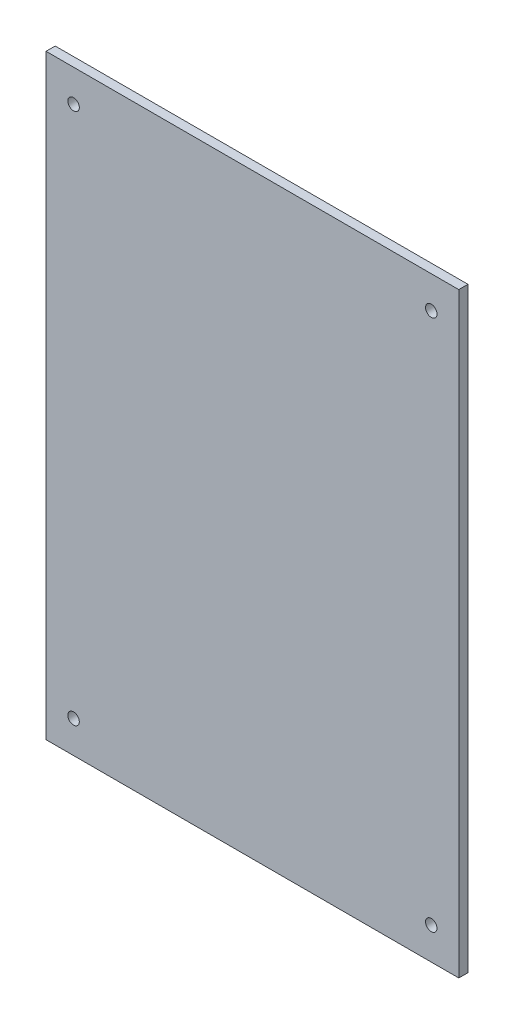
from build123d import *

# Parameters (mm, degrees)
SKETCH1_W     = 180
SKETCH1_H     = 260
SKETCH1_R     = 2.5
PROFILE_DEPTH = 4


with BuildPart() as part:
    # Sketch1 → Profile (new body)
    with BuildSketch(Plane.XY):
        with Locations((90, 130)):
            Rectangle(SKETCH1_W, SKETCH1_H)
        with Locations((12, 14)):
            Circle(SKETCH1_R, mode=Mode.SUBTRACT)
        with Locations((12, 246)):
            Circle(SKETCH1_R, mode=Mode.SUBTRACT)
        with Locations((168, 14)):
            Circle(SKETCH1_R, mode=Mode.SUBTRACT)
        with Locations((168, 246)):
            Circle(SKETCH1_R, mode=Mode.SUBTRACT)
    extrude(amount=PROFILE_DEPTH)


solid = part.part
